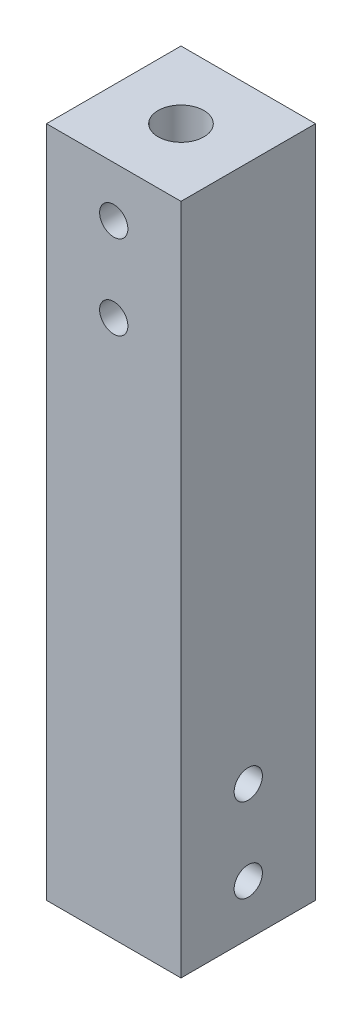
from build123d import *

# Parameters (mm, degrees)
SKETCH1_W             = 20
SKETCH1_H             = 20
BOSS_EXTRUDE1_DEPTH   = 100
M5_TAPPED_HOLE1_D     = 4.2
M5_TAPPED_HOLE1_DEPTH = 12.4
M5_TAPPED_HOLE1_TIP   = 1.2618073
M5_TAPPED_HOLE2_D     = 4.2
M5_TAPPED_HOLE2_DEPTH = 12.4
M5_TAPPED_HOLE2_TIP   = 1.2618073


with BuildPart() as part:
    # Sketch1 → Boss-Extrude1 (new body)
    with BuildSketch(Plane(origin=(0, 0, 0), x_dir=(1, 0, 0), z_dir=(0, 1, 0))):
        with Locations((10, 10)):
            Rectangle(SKETCH1_W, SKETCH1_H)
    extrude(amount=BOSS_EXTRUDE1_DEPTH)

    # Sketch5 → M8 Tapped Hole1 (revolve, cut)
    with BuildSketch(Plane(origin=(10, 100, -10), x_dir=(0, 0, 1), z_dir=(1, 0, 0))):
        Polygon((0, 0), (0, 15.792926105), (3.4, 13.75), (3.4, 0), align=None)
    m8_tapped_hole1 = revolve(axis=Axis((10, 106.35, -10), (0, -1, 0)), mode=Mode.SUBTRACT)

    # Mirror1: M8 Tapped Hole1 across plane
    add(m8_tapped_hole1.mirror(Plane.ZX.offset(50)), mode=Mode.SUBTRACT)

    # M5 Tapped Hole1
    with Locations(Plane.XY):
        with Locations((10, 80), (10, 92.5)):
            Hole(M5_TAPPED_HOLE1_D / 2, depth=M5_TAPPED_HOLE1_DEPTH)
            with Locations((0, 0, -(M5_TAPPED_HOLE1_DEPTH + M5_TAPPED_HOLE1_TIP / 2))):  # 118° drill point
                Cone(0, M5_TAPPED_HOLE1_D / 2, M5_TAPPED_HOLE1_TIP, mode=Mode.SUBTRACT)

    # M5 Tapped Hole2
    with Locations(Plane(origin=(20, 0, 0), x_dir=(0, 0, -1), z_dir=(1, 0, 0))):
        with Locations((10, 7.5), (10, 20)):
            Hole(M5_TAPPED_HOLE2_D / 2, depth=M5_TAPPED_HOLE2_DEPTH)
            with Locations((0, 0, -(M5_TAPPED_HOLE2_DEPTH + M5_TAPPED_HOLE2_TIP / 2))):  # 118° drill point
                Cone(0, M5_TAPPED_HOLE2_D / 2, M5_TAPPED_HOLE2_TIP, mode=Mode.SUBTRACT)


solid = part.part
